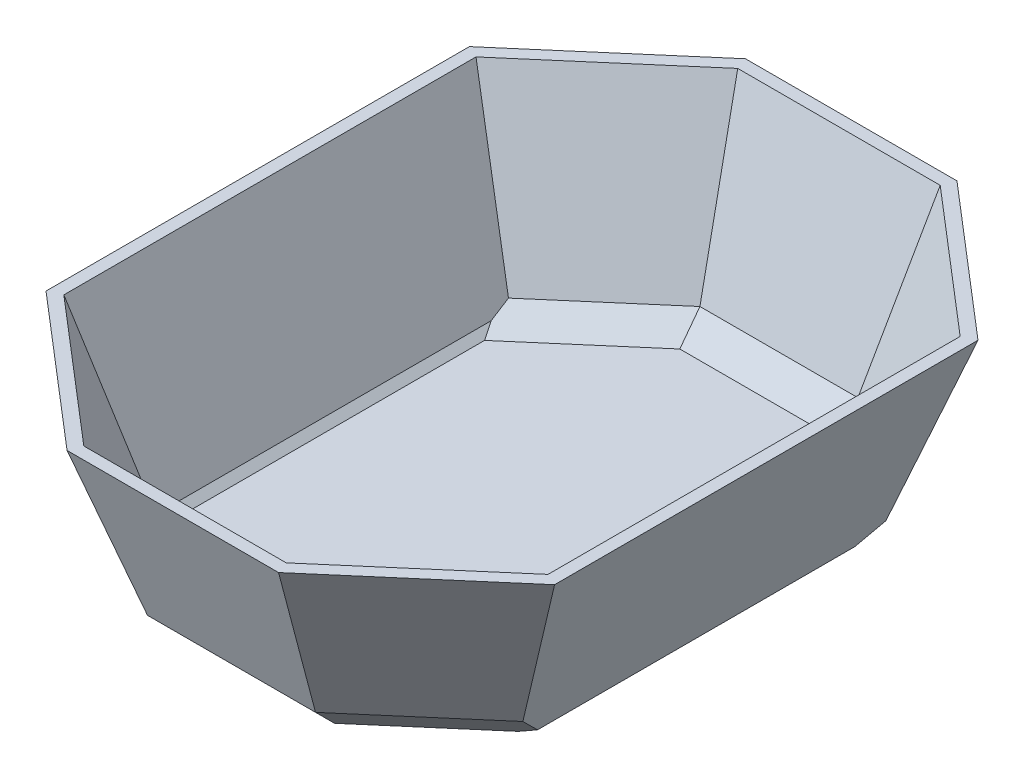
from build123d import *
from OCP.BRepFilletAPI import BRepFilletAPI_MakeChamfer

# Parameters (mm, degrees)
SKETCH1_W           = 96.449496644
SKETCH1_H           = 93.866027984
BOSS_EXTRUDE1_DEPTH = 50
DRAFT1_ANGLE        = 20
CHAMFER1_SIZE       = 5
CHAMFER1_SIZE2      = 8.365785926
CHAMFER2_SIZE       = 2
CHAMFER2_SIZE2      = 3.34631437
SHELL1_T            = -3


with BuildPart() as part:
    # Sketch1 → Boss-Extrude1 (new body)
    with BuildSketch(Plane(origin=(0, 0, 0), x_dir=(1, 0, 0), z_dir=(0, 1, 0))):
        Rectangle(SKETCH1_W, SKETCH1_H)
        Polygon((20.883038336, 70.399520989), (48.224748322, 46.933013992), (-48.224748322, 46.933013992), (-20.883038336, 70.399520989), align=None)
        Polygon((-48.224748322, -46.933013992), (48.224748322, -46.933013992), (20.883038336, -70.399520989), (-20.883038336, -70.399520989), align=None)
    extrude(amount=BOSS_EXTRUDE1_DEPTH)

    # Draft1
    draft1_faces = [part.faces().sort_by_distance(p)[0] for p in [
        (-34.553893329, 25, 58.66626749),
        (-48.224748322, 25, 0),
        (-34.553893329, 25, -58.66626749),
        (0, 25, -70.399520989),
        (34.553893329, 25, -58.66626749),
        (48.224748322, 25, 0),
        (34.553893329, 25, 58.66626749),
        (0, 25, 70.399520989),
    ]]
    draft(draft1_faces, Plane(origin=(0, 0, 0), x_dir=(0, 0, -1), z_dir=(0, -1, 0)), DRAFT1_ANGLE)

    # Chamfer1: one chamfer whose edges measure the first distance from different faces: ONE call of the kernel's chamfer builder (chamfer() names one face for all edges)
    chamfer1_edges_1 = [part.edges().sort_by_distance(p)[0] for p in [
        (0, 0, 70.399520989),
        (-34.553893329, 0, 58.66626749),
        (34.553893329, 0, 58.66626749),
    ]]
    chamfer1_side_1 = [part.faces().sort_by_distance(p)[0] for p in [
        (0, 0, 0),
    ]]
    chamfer1_edges_2 = [part.edges().sort_by_distance(p)[0] for p in [
        (-34.553893329, 0, -58.66626749),
    ]]
    chamfer1_side_2 = [part.faces().sort_by_distance(p)[0] for p in [
        (-41.148260159, 26.443805038, -65.690138569),
    ]]
    chamfer1_edges_3 = [part.edges().sort_by_distance(p)[0] for p in [
        (0, 0, -70.399520989),
    ]]
    chamfer1_side_3 = [part.faces().sort_by_distance(p)[0] for p in [
        (0, 26.157748942, -79.920162999),
    ]]
    chamfer1_edges_4 = [part.edges().sort_by_distance(p)[0] for p in [
        (34.553893329, 0, -58.66626749),
    ]]
    chamfer1_side_4 = [part.faces().sort_by_distance(p)[0] for p in [
        (41.148260159, 26.443805038, -65.690138569),
    ]]
    chamfer1 = BRepFilletAPI_MakeChamfer(part.part.solid().wrapped)
    for e in chamfer1_edges_1:
        chamfer1.Add(CHAMFER1_SIZE, CHAMFER1_SIZE2, e.wrapped, chamfer1_side_1[0].wrapped)  # the first distance lies on this face
    for e in chamfer1_edges_2:
        chamfer1.Add(CHAMFER1_SIZE, CHAMFER1_SIZE2, e.wrapped, chamfer1_side_2[0].wrapped)  # the first distance lies on this face
    for e in chamfer1_edges_3:
        chamfer1.Add(CHAMFER1_SIZE, CHAMFER1_SIZE2, e.wrapped, chamfer1_side_3[0].wrapped)  # the first distance lies on this face
    for e in chamfer1_edges_4:
        chamfer1.Add(CHAMFER1_SIZE, CHAMFER1_SIZE2, e.wrapped, chamfer1_side_4[0].wrapped)  # the first distance lies on this face
    add(Compound.cast(chamfer1.Shape()), mode=Mode.REPLACE)

    # Chamfer2: one chamfer whose edges measure the first distance from different faces: ONE call of the kernel's chamfer builder (chamfer() names one face for all edges)
    chamfer2_edges_1 = [part.edges().sort_by_distance(p)[0] for p in [
        (48.224748322, 0, 2.217733352),
    ]]
    chamfer2_side_1 = [part.faces().sort_by_distance(p)[0] for p in [
        (57.660024046, 25.923206996, -0.008470654),
    ]]
    chamfer2_edges_2 = [part.edges().sort_by_distance(p)[0] for p in [
        (-48.224748322, 0, 2.217733352),
    ]]
    chamfer2_side_2 = [part.faces().sort_by_distance(p)[0] for p in [
        (0, 0, 1.984639343),
    ]]
    chamfer2 = BRepFilletAPI_MakeChamfer(part.part.solid().wrapped)
    for e in chamfer2_edges_1:
        chamfer2.Add(CHAMFER2_SIZE, CHAMFER2_SIZE2, e.wrapped, chamfer2_side_1[0].wrapped)  # the first distance lies on this face
    for e in chamfer2_edges_2:
        chamfer2.Add(CHAMFER2_SIZE, CHAMFER2_SIZE2, e.wrapped, chamfer2_side_2[0].wrapped)  # the first distance lies on this face
    add(Compound.cast(chamfer2.Shape()), mode=Mode.REPLACE)

    # Shell1
    shell1_openings = [part.faces().sort_by_distance(p)[0] for p in [
        (0, 50, 0),
    ]]
    offset(amount=SHELL1_T, openings=shell1_openings, kind=Kind.INTERSECTION)


solid = part.part
